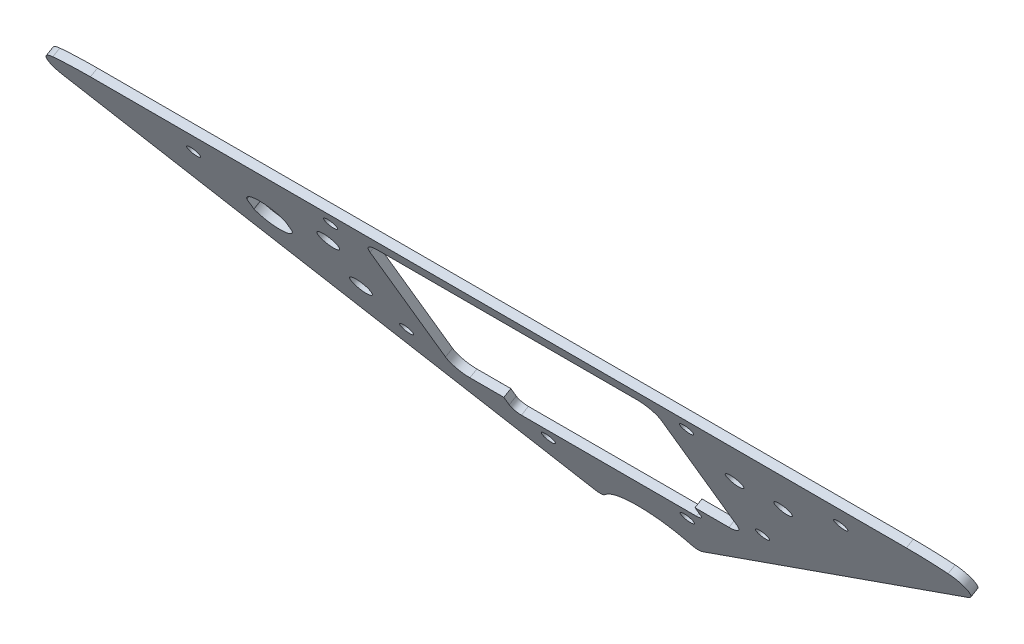
from build123d import *

# Parameters (mm, degrees)
SKETCH2_R           = 2.4892
BOSS_EXTRUDE1_DEPTH = 3.175
SKETCH4_R           = 2.4892
CUT_EXTRUDE1_DEPTH  = 919.047972743
SKETCH6_R           = 4
CUT_EXTRUDE3_DEPTH  = 919.045301638
CUT_EXTRUDE2_DEPTH  = 919.047972743
SKETCH7_R           = 3.2639
CUT_EXTRUDE4_DEPTH  = 919.047972743
CUT_EXTRUDE5_DEPTH  = 919.047972743


with BuildPart() as part:
    # Sketch2 → Boss-Extrude1 (new body)
    with BuildSketch(Plane(origin=(0, -119.026177706, 202.518411263), x_dir=(-1, 0, 0), z_dir=(-7.267823095607155e-15, 0.506696551391541, -0.8621244717602671))):
        with BuildLine():
            Line((21.054229278, 782.405033139), (177.875467972, 885.559604741))
            ThreePointArc((177.875467972, 885.559604741), (180.62401835, 892.051058523), (175.684594577, 897.080531077))
            ThreePointArc((175.684594577, 897.080531077), (167.933410831, 898.287628232), (160.099198372, 898.691420443))
            Line((160.099198372, 898.691420443), (-160.099198372, 898.691420443))
            ThreePointArc((-160.099198372, 898.691420443), (-167.933410831, 898.287628232), (-175.684594577, 897.080531077))
            ThreePointArc((-175.684594577, 897.080531077), (-180.62401835, 892.051058523), (-177.875467972, 885.559604741))
            Line((-177.875467972, 885.559604741), (-21.054229278, 782.405033139))
            ThreePointArc((-21.054229278, 782.405033139), (-18.86350312, 781.91408365), (-16.895725938, 782.994900685))
            ThreePointArc((-16.895725938, 782.994900685), (0, 790.780888599), (16.895725938, 782.994900685))
            ThreePointArc((16.895725938, 782.994900685), (18.86350312, 781.91408365), (21.054229278, 782.405033139))
        make_face()
        with Locations((-127, 884.16502092)):
            Circle(SKETCH2_R, mode=Mode.SUBTRACT)
        with Locations((-27.242242795, 806.191391474)):
            Circle(SKETCH2_R, mode=Mode.SUBTRACT)
        with Locations((27.242242795, 806.191391474)):
            Circle(SKETCH2_R, mode=Mode.SUBTRACT)
        with Locations((127, 884.16502092)):
            Circle(SKETCH2_R, mode=Mode.SUBTRACT)
    extrude(amount=BOSS_EXTRUDE1_DEPTH)

    # Sketch4 → Cut-Extrude1 (cut, through all)
    with BuildSketch(Plane(origin=(0, -117.417416155, 199.781166065), x_dir=(-1, 0, 0), z_dir=(-7.267823095607155e-15, 0.506696551391541, -0.8621244717602671))):
        with Locations((-69.85, 890.753920443)):
            Circle(SKETCH4_R)
        with Locations((-69.85, 832.016420443)):
            Circle(SKETCH4_R)
        with Locations((69.85, 832.016420443)):
            Circle(SKETCH4_R)
        with Locations((69.85, 890.753920443)):
            Circle(SKETCH4_R)
    extrude(amount=-CUT_EXTRUDE1_DEPTH, mode=Mode.SUBTRACT)

    # Sketch6 → Cut-Extrude3 (cut, through all)
    with BuildSketch(Plane(origin=(0, -119.026177706, 202.518411263), x_dir=(1, 0, 0), z_dir=(7.267823095607155e-15, -0.506696551391541, 0.8621244717602671))):
        with Locations((-79.654, 873.291420443)):
            Circle(SKETCH6_R)
        with Locations((-79.654, 847.891420443)):
            Circle(SKETCH6_R)
    extrude(amount=-CUT_EXTRUDE3_DEPTH, mode=Mode.SUBTRACT)

    # Sketch5 → Cut-Extrude2 (cut, through all)
    with BuildSketch(Plane(origin=(0, -117.417416155, 199.781166065), x_dir=(-1, 0, 0), z_dir=(-7.267823095607155e-15, 0.506696551391541, -0.8621244717602671))):
        with BuildLine():
            Line((99.215659501, 862.570038261), (99.215659501, 868.137802624))
            ThreePointArc((99.215659501, 868.137802624), (106.715659501, 873.353920443), (114.215659501, 868.137802624))
            Line((114.215659501, 868.137802624), (114.215659501, 862.570038261))
            ThreePointArc((114.215659501, 862.570038261), (106.715659501, 857.353920443), (99.215659501, 862.570038261))
        make_face()
    extrude(amount=-CUT_EXTRUDE2_DEPTH, mode=Mode.SUBTRACT)

    # Sketch7 → Cut-Extrude4 (cut, through all)
    with BuildSketch(Plane(origin=(0, -117.417416155, 199.781166065), x_dir=(-1, 0, 0), z_dir=(-7.267823095607155e-15, 0.506696551391541, -0.8621244717602671))):
        with Locations((-76.975, 867.735170443)):
            Circle(SKETCH7_R)
        with Locations((-96.025, 867.735170443)):
            Circle(SKETCH7_R)
    extrude(amount=-CUT_EXTRUDE4_DEPTH, mode=Mode.SUBTRACT)

    # Sketch8 → Cut-Extrude5 (cut, through all)
    with BuildSketch(Plane(origin=(0, -117.417416155, 199.781166065), x_dir=(-1, 0, 0), z_dir=(-7.267823095607155e-15, 0.506696551391541, -0.8621244717602671))):
        with BuildLine():
            Line((50.825, 891.603920443), (-50.825, 891.603920443))
            ThreePointArc((-50.825, 891.603920443), (-55.315128061, 889.744048503), (-57.175, 885.253920443))
            Line((-57.175, 885.253920443), (-57.175, 826.803920443))
            ThreePointArc((-57.175, 826.803920443), (-55.315128061, 822.313792382), (-50.825, 820.453920443))
            Line((-50.825, 820.453920443), (-37.5, 820.453920443))
            Line((-37.5, 820.453920443), (-37.5, 816.287420443))
            ThreePointArc((-37.5, 816.287420443), (-36.57006403, 814.042356413), (-34.325, 813.112420443))
            Line((-34.325, 813.112420443), (34.325, 813.112420443))
            ThreePointArc((34.325, 813.112420443), (36.57006403, 814.042356413), (37.5, 816.287420443))
            Line((37.5, 816.287420443), (37.5, 820.453920443))
            Line((37.5, 820.453920443), (50.825, 820.453920443))
            ThreePointArc((50.825, 820.453920443), (55.315128061, 822.313792382), (57.175, 826.803920443))
            Line((57.175, 826.803920443), (57.175, 885.253920443))
            ThreePointArc((57.175, 885.253920443), (55.315128061, 889.744048503), (50.825, 891.603920443))
        make_face()
    extrude(amount=-CUT_EXTRUDE5_DEPTH, mode=Mode.SUBTRACT)


solid = part.part
